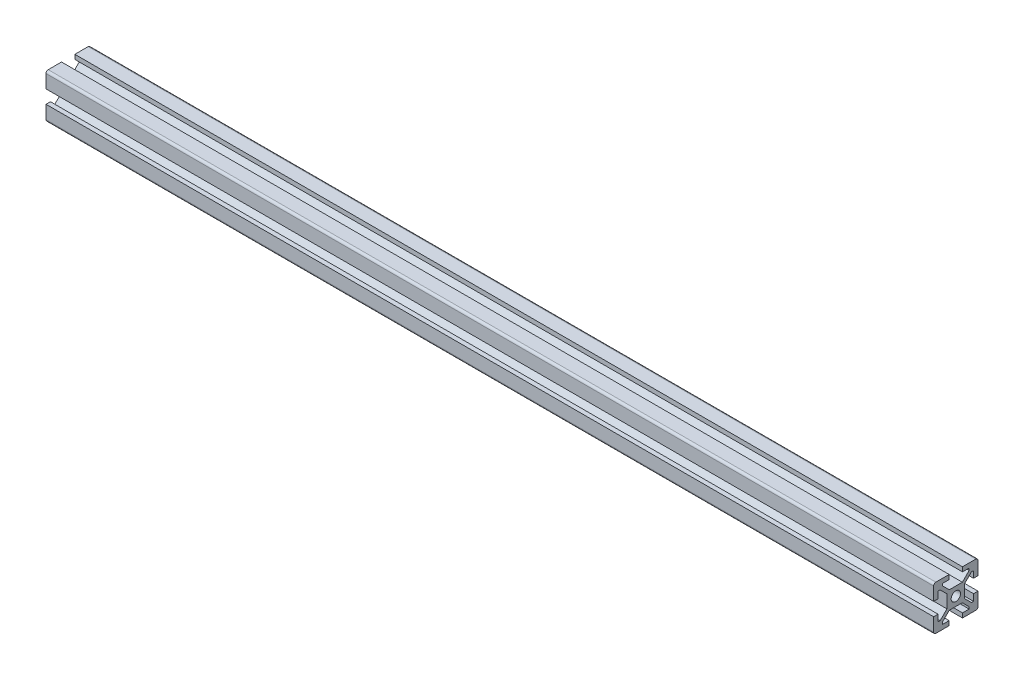
from build123d import *

# Parameters (mm, degrees)
SKETCH1_R           = 2.1
BOSS_EXTRUDE1_DEPTH = 400


with BuildPart() as part:
    # Sketch1 → Boss-Extrude1 (new body)
    with BuildSketch(Plane(origin=(0, 0, 0), x_dir=(0, 0, -1), z_dir=(1, 0, 0))):
        with BuildLine():
            Line((-10, 9), (-10, 3))
            Line((-10, 3), (-8, 3))
            Line((-8, 3), (-8, 6))
            Line((-8, 6), (-7.060660172, 6))
            Line((-7.060660172, 6), (-4, 2.939339828))
            Line((-4, 2.939339828), (-4, -2.939339828))
            Line((-4, -2.939339828), (-7.060660172, -6))
            Line((-7.060660172, -6), (-8, -6))
            Line((-8, -6), (-8, -3))
            Line((-8, -3), (-10, -3))
            Line((-10, -3), (-10, -9))
            ThreePointArc((-10, -9), (-9.707106781, -9.707106781), (-9, -10))
            Line((-9, -10), (-3, -10))
            Line((-3, -10), (-3, -8))
            Line((-3, -8), (-6, -8))
            Line((-6, -8), (-6, -7.060660172))
            Line((-6, -7.060660172), (-2.939339828, -4))
            Line((-2.939339828, -4), (2.939339828, -4))
            Line((2.939339828, -4), (6, -7.060660172))
            Line((6, -7.060660172), (6, -8))
            Line((6, -8), (3, -8))
            Line((3, -8), (3, -10))
            Line((3, -10), (9, -10))
            ThreePointArc((9, -10), (9.707106781, -9.707106781), (10, -9))
            Line((10, -9), (10, -3))
            Line((10, -3), (8, -3))
            Line((8, -3), (8, -6))
            Line((8, -6), (7.060660172, -6))
            Line((7.060660172, -6), (4, -2.939339828))
            Line((4, -2.939339828), (4, 2.939339828))
            Line((4, 2.939339828), (7.060660172, 6))
            Line((7.060660172, 6), (8, 6))
            Line((8, 6), (8, 3))
            Line((8, 3), (10, 3))
            Line((10, 3), (10, 9))
            ThreePointArc((10, 9), (9.707106781, 9.707106781), (9, 10))
            Line((9, 10), (3, 10))
            Line((3, 10), (3, 8))
            Line((3, 8), (6, 8))
            Line((6, 8), (6, 7.060660172))
            Line((6, 7.060660172), (2.939339828, 4))
            Line((2.939339828, 4), (-2.939339828, 4))
            Line((-2.939339828, 4), (-6, 7.060660172))
            Line((-6, 7.060660172), (-6, 8))
            Line((-6, 8), (-3, 8))
            Line((-3, 8), (-3, 10))
            Line((-3, 10), (-9, 10))
            ThreePointArc((-9, 10), (-9.707106781, 9.707106781), (-10, 9))
        make_face()
        Circle(SKETCH1_R, mode=Mode.SUBTRACT)
    extrude(amount=BOSS_EXTRUDE1_DEPTH)


solid = part.part
